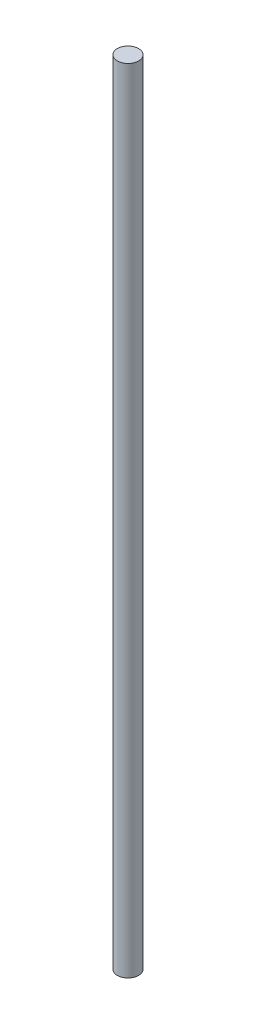
from build123d import *

# Parameters (mm, degrees)
SKETCH1_R           = 3.175
BOSS_EXTRUDE1_DEPTH = 234.95


with BuildPart() as part:
    # Sketch1 → Boss-Extrude1 (new body)
    with BuildSketch(Plane(origin=(0, 0, 0), x_dir=(1, 0, 0), z_dir=(0, 1, 0))):
        Circle(SKETCH1_R)
    extrude(amount=BOSS_EXTRUDE1_DEPTH)


solid = part.part
